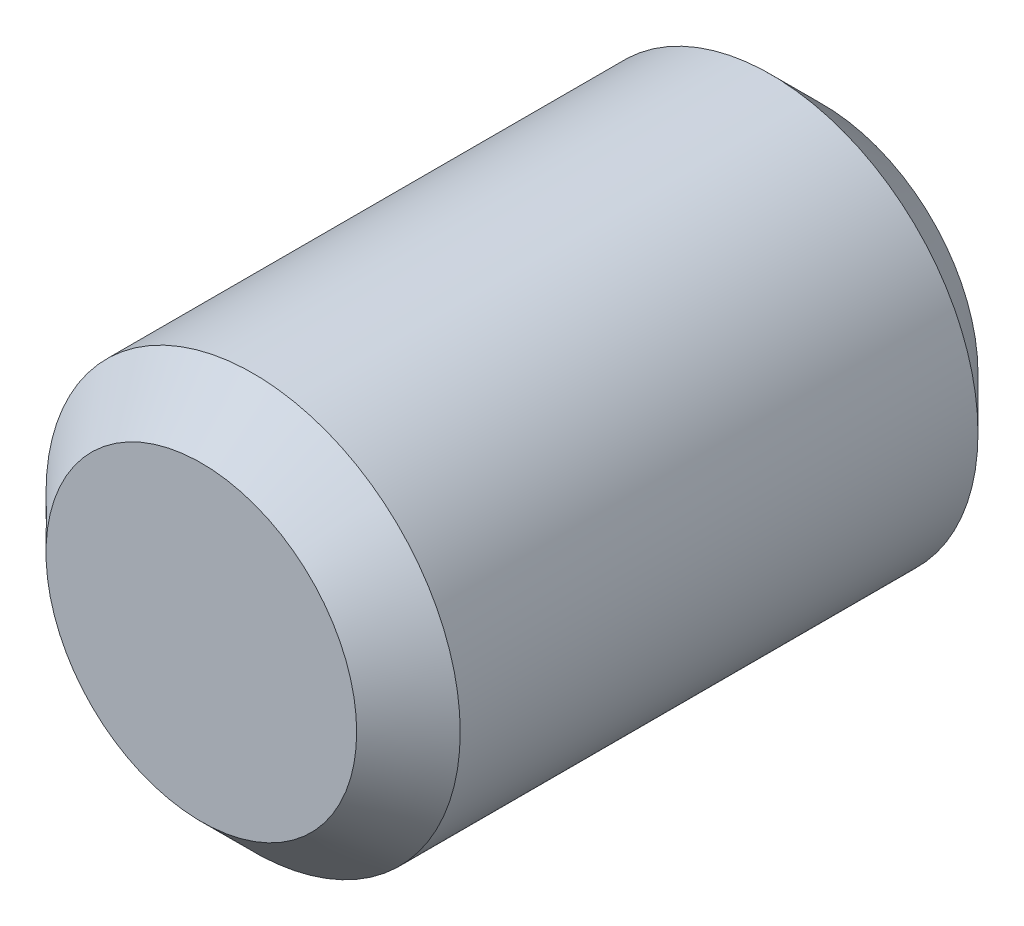
from build123d import *

# Parameters (mm, degrees)
SKETCH1_R      = 4
EXTRUDE1_DEPTH = 6
CHAMFER1_SIZE  = 1


with BuildPart() as part:
    # Sketch1 → Extrude1 (new, symmetric)
    with BuildSketch(Plane.XY):
        Circle(SKETCH1_R)
    extrude(amount=EXTRUDE1_DEPTH, both=True)

    # Chamfer1
    chamfer1_edges = [part.edges().sort_by_distance(p)[0] for p in [
        (-4, 0, -6),
        (-4, 0, 6),
    ]]
    chamfer(chamfer1_edges, length=CHAMFER1_SIZE)


solid = part.part
